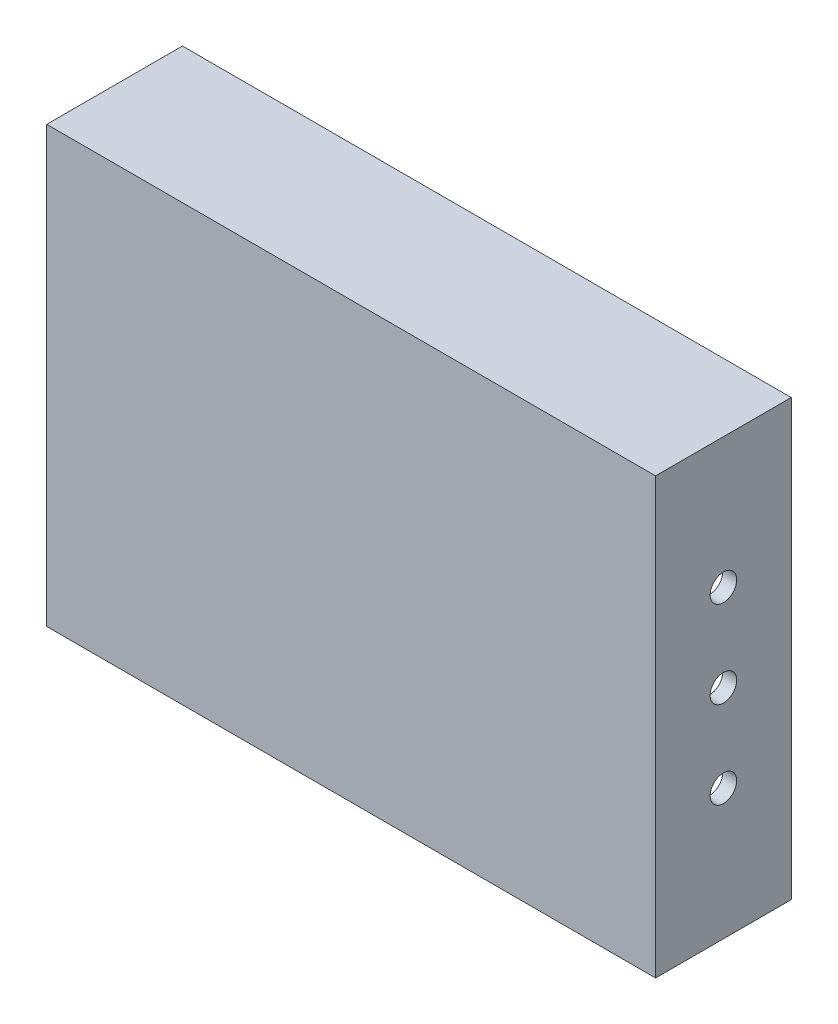
from build123d import *

# Parameters (mm, degrees)
SKETCH1_W           = 175
SKETCH1_H           = 125
BOSS_EXTRUDE1_DEPTH = 35
SKETCH2_W           = 175
SKETCH2_H           = 125
BOSS_EXTRUDE2_DEPTH = 4
SKETCH3_R           = 2.045
CUT_EXTRUDE1_DEPTH  = 6
SKETCH4_R           = 3.81
CUT_EXTRUDE2_DEPTH  = 10
SKETCH5_R           = 6
SKETCH5_R_2         = 6.35
CUT_EXTRUDE3_DEPTH  = 10


with BuildPart() as part:
    # Sketch1 → Boss-Extrude1 (new body)
    with BuildSketch(Plane.XY):
        with Locations((-87.5, 62.5)):
            Rectangle(SKETCH1_W, SKETCH1_H)
        Polygon((-93.5, 121), (-164, 121), (-164, 114), (-171, 114), (-171, 11), (-164, 11), (-164, 4), (-93.5, 4), (-93.5, 11), (-81.5, 11), (-81.5, 4), (-11, 4), (-11, 11), (-4, 11), (-4, 114), (-11, 114), (-11, 121), (-81.5, 121), (-81.5, 114), (-93.5, 114), align=None, mode=Mode.SUBTRACT)
    extrude(amount=BOSS_EXTRUDE1_DEPTH)

    # Sketch2 → Boss-Extrude2 (add)
    with BuildSketch(Plane.XY.offset(35)):
        with Locations((-87.5, 62.5)):
            Rectangle(SKETCH2_W, SKETCH2_H)
    extrude(amount=BOSS_EXTRUDE2_DEPTH)

    # Sketch3 → Cut-Extrude1 (cut)
    with BuildSketch(Plane(origin=(0, 0, 0), x_dir=(-1, 0, 0), z_dir=(0, 0, -1))):
        with Locations((6, 119)):
            Circle(SKETCH3_R)
        with Locations((87.5, 119)):
            Circle(SKETCH3_R)
        with Locations((169, 119)):
            Circle(SKETCH3_R)
        with Locations((169, 6)):
            Circle(SKETCH3_R)
        with Locations((87.5, 6)):
            Circle(SKETCH3_R)
        with Locations((6, 6)):
            Circle(SKETCH3_R)
    extrude(amount=-CUT_EXTRUDE1_DEPTH, mode=Mode.SUBTRACT)

    # Sketch4 → Cut-Extrude2 (cut)
    with BuildSketch(Plane(origin=(0, 0, 0), x_dir=(0, 0, -1), z_dir=(1, 0, 0))):
        with Locations((-19.5, 87.5)):
            Circle(SKETCH4_R)
        with Locations((-19.5, 62.5)):
            Circle(SKETCH4_R)
        with Locations((-19.5, 37.5)):
            Circle(SKETCH4_R)
    extrude(amount=-CUT_EXTRUDE2_DEPTH, mode=Mode.SUBTRACT)

    # Sketch5 → Cut-Extrude3 (cut)
    with BuildSketch(Plane.ZY.offset(175)):
        with Locations((19.5, 100)):
            Circle(SKETCH5_R)
        with Locations((19.5, 75)):
            Circle(SKETCH5_R_2)
    extrude(amount=-CUT_EXTRUDE3_DEPTH, mode=Mode.SUBTRACT)


solid = part.part
